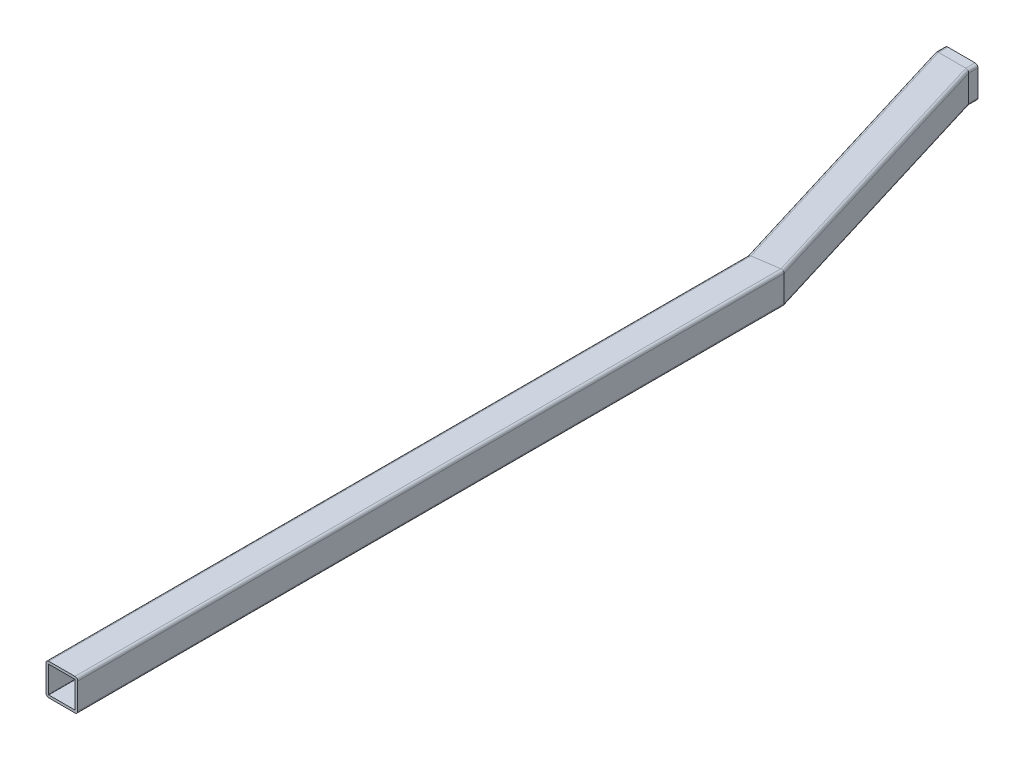
from build123d import *

# Parameters (mm, degrees)
STRUCTURAL_MEMBER1_DEPTH        = 228.438824066
STRUCTURAL_MEMBER1_2_DEPTH      = 555
STRUCTURAL_MEMBER1_2_DEPTH_BACK = 3.638824066
CUT_EXTRUDE1_DEPTH              = 74
BOSS_EXTRUDE1_DEPTH             = 7.304


with BuildPart() as part:
    # Sketch11 on segment 1 (carried to segment 1) → Structural Member1 (new body)
    with BuildSketch(Plane(origin=(-392.417056908, 0, -470), x_dir=(0.956405694, 0, -0.292041347), z_dir=(0.292041347, 0, 0.956405694))):
        with BuildLine():
            Line((-10.3, -12.5), (10.3, -12.5))
            ThreePointArc((10.3, -12.5), (11.855634919, -11.855634919), (12.5, -10.3))
            Line((12.5, -10.3), (12.5, 10.3))
            ThreePointArc((12.5, 10.3), (11.855634919, 11.855634919), (10.3, 12.5))
            Line((10.3, 12.5), (-10.3, 12.5))
            ThreePointArc((-10.3, 12.5), (-11.855634919, 11.855634919), (-12.5, 10.3))
            Line((-12.5, 10.3), (-12.5, -10.3))
            ThreePointArc((-12.5, -10.3), (-11.855634919, -11.855634919), (-10.3, -12.5))
        make_face()
        with BuildLine():
            Line((-10.3, -10.5), (10.3, -10.5))
            ThreePointArc((10.3, -10.5), (10.441421356, -10.441421356), (10.5, -10.3))
            Line((10.5, -10.3), (10.5, 10.3))
            ThreePointArc((10.5, 10.3), (10.441421356, 10.441421356), (10.3, 10.5))
            Line((10.3, 10.5), (-10.3, 10.5))
            ThreePointArc((-10.3, 10.5), (-10.441421356, 10.441421356), (-10.5, 10.3))
            Line((-10.5, 10.3), (-10.5, -10.3))
            ThreePointArc((-10.5, -10.3), (-10.441421356, -10.441421356), (-10.3, -10.5))
        make_face(mode=Mode.SUBTRACT)
    extrude(amount=STRUCTURAL_MEMBER1_DEPTH)

    # Structural Member1 mitre 1
    split(bisect_by=Plane(origin=(-326.766162017, 0, -255), x_dir=(0, 1, 0), z_dir=(-0.147638589, 0, -0.989041378)), keep=Keep.TOP)

    # Sketch13 → Cut-Extrude1 (cut)
    with BuildSketch(Plane(origin=(0, 42.5, 0), x_dir=(-1, 0, 0), z_dir=(0, 1, 0))):
        Polygon((404.372128083, -466.349483158), (378.232593199, -466.349483158), (380.461985734, -473.650516842), align=None)
    extrude(amount=-CUT_EXTRUDE1_DEPTH, mode=Mode.SUBTRACT)


with BuildPart() as body_2:
    # Sketch11 → Structural Member1 2 (new, two sides: drawn at the far end of the back side and taken through both)
    with BuildSketch(Plane(origin=(-326.766162017, 0, -255), x_dir=(1, 0, 0), z_dir=(0, 0, 1)).offset(-STRUCTURAL_MEMBER1_2_DEPTH_BACK)):
        with BuildLine():
            Line((-10.3, -12.5), (10.3, -12.5))
            ThreePointArc((10.3, -12.5), (11.855634919, -11.855634919), (12.5, -10.3))
            Line((12.5, -10.3), (12.5, 10.3))
            ThreePointArc((12.5, 10.3), (11.855634919, 11.855634919), (10.3, 12.5))
            Line((10.3, 12.5), (-10.3, 12.5))
            ThreePointArc((-10.3, 12.5), (-11.855634919, 11.855634919), (-12.5, 10.3))
            Line((-12.5, 10.3), (-12.5, -10.3))
            ThreePointArc((-12.5, -10.3), (-11.855634919, -11.855634919), (-10.3, -12.5))
        make_face()
        with BuildLine():
            Line((-10.3, -10.5), (10.3, -10.5))
            ThreePointArc((10.3, -10.5), (10.441421356, -10.441421356), (10.5, -10.3))
            Line((10.5, -10.3), (10.5, 10.3))
            ThreePointArc((10.5, 10.3), (10.441421356, 10.441421356), (10.3, 10.5))
            Line((10.3, 10.5), (-10.3, 10.5))
            ThreePointArc((-10.3, 10.5), (-10.441421356, 10.441421356), (-10.5, 10.3))
            Line((-10.5, 10.3), (-10.5, -10.3))
            ThreePointArc((-10.5, -10.3), (-10.441421356, -10.441421356), (-10.3, -10.5))
        make_face(mode=Mode.SUBTRACT)
    extrude(amount=STRUCTURAL_MEMBER1_2_DEPTH + STRUCTURAL_MEMBER1_2_DEPTH_BACK)

    # Structural Member1 2 mitre 1
    split(bisect_by=Plane(origin=(-326.766162017, 0, -255), x_dir=(0, -1, 0), z_dir=(0.147638589, 0, 0.989041378)), keep=Keep.TOP)


with BuildPart() as body_3:
    # Sketch14 → Boss-Extrude1 (new body)
    with BuildSketch(Plane(origin=(0, 0, -466.349483158), x_dir=(-1, 0, 0), z_dir=(0, 0, -1))):
        with BuildLine():
            Line((378.232593199, 10.3), (378.232593199, -10.3))
            add(Edge.make_bspline(
                [(378.232593199, -10.3), (378.232593199, -12.5), (380.532872269, -12.5)],
                knots=[3.141592654, 3.141592654, 3.141592654, 4.71238898, 4.71238898, 4.71238898], degree=2, weights=[1, 0.707106781, 1]))
            Line((380.532872269, -12.5), (402.071849013, -12.5))
            add(Edge.make_bspline(
                [(402.071849013, -12.5), (404.372128083, -12.5), (404.372128083, -10.3)],
                knots=[4.71238898, 4.71238898, 4.71238898, 6.283185307, 6.283185307, 6.283185307], degree=2, weights=[1, 0.707106781, 1]))
            Line((404.372128083, -10.3), (404.372128083, 10.3))
            add(Edge.make_bspline(
                [(404.372128083, 10.3), (404.372128083, 12.5), (402.071849013, 12.5)],
                knots=[0, 0, 0, 1.570796327, 1.570796327, 1.570796327], degree=2, weights=[1, 0.707106781, 1]))
            Line((402.071849013, 12.5), (380.532872269, 12.5))
            add(Edge.make_bspline(
                [(380.532872269, 12.5), (378.232593199, 12.5), (378.232593199, 10.3)],
                knots=[1.570796327, 1.570796327, 1.570796327, 3.141592654, 3.141592654, 3.141592654], degree=2, weights=[1, 0.707106781, 1]))
        make_face()
    extrude(amount=BOSS_EXTRUDE1_DEPTH)


solid = Compound([part.part, body_2.part, body_3.part])
